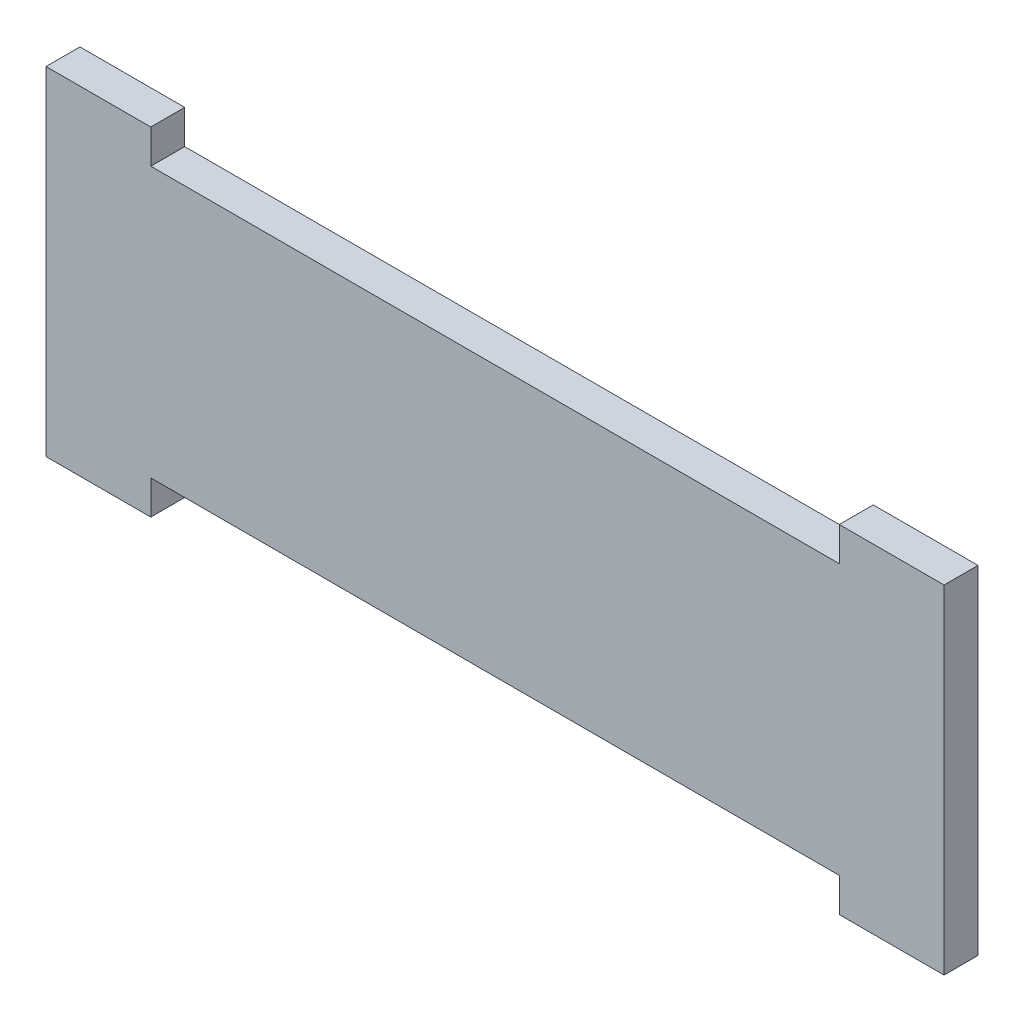
from build123d import *

# Parameters (mm, degrees)
SKETCH2_W           = 4.9
SKETCH2_H           = 1.5875
BOSS_EXTRUDE1_DEPTH = 1.5875


with BuildPart() as part:
    # Sketch2 → Boss-Extrude1 (new body)
    with BuildSketch(Plane.XY):
        Polygon((-9, -7.9), (-51, -7.9), (-51, -14.2125), (-46.1, -14.2125), (-13.9, -14.2125), (-9, -14.2125), align=None)
        with Locations((-48.55, -15.00625)):
            Rectangle(SKETCH2_W, SKETCH2_H)
        Polygon((-13.9, -1.5875), (-46.1, -1.5875), (-51, -1.5875), (-51, -7.9), (-9, -7.9), (-9, -1.5875), align=None)
        with Locations((-48.55, -0.79375)):
            Rectangle(SKETCH2_W, SKETCH2_H)
        with Locations((-11.45, -0.79375)):
            Rectangle(SKETCH2_W, SKETCH2_H)
        with Locations((-11.45, -15.00625)):
            Rectangle(SKETCH2_W, SKETCH2_H)
    extrude(amount=BOSS_EXTRUDE1_DEPTH)


solid = part.part
